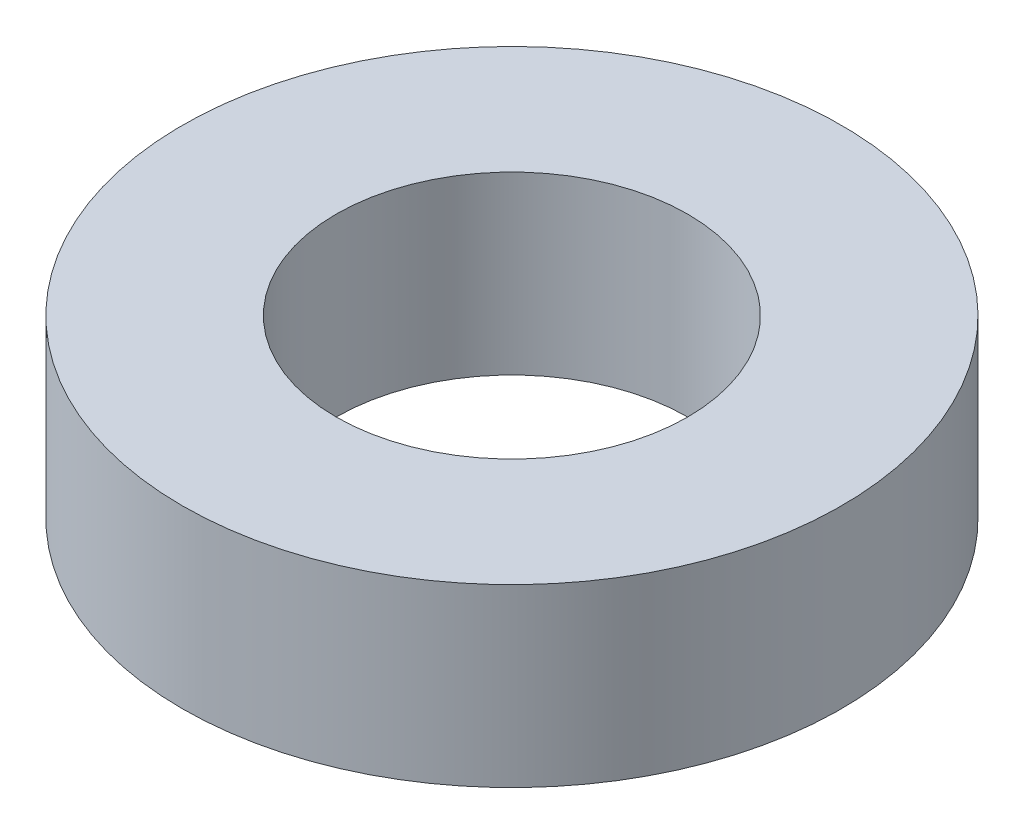
from build123d import *

# Parameters (mm, degrees)
SKETCH1_R           = 11.90625
SKETCH1_R_2         = 6.35
BOSS_EXTRUDE1_DEPTH = 6.35


with BuildPart() as part:
    # Sketch1 → Boss-Extrude1 (new body)
    with BuildSketch(Plane(origin=(0, 0, 0), x_dir=(1, 0, 0), z_dir=(0, 1, 0))):
        with Locations(Location((0, 0, 0), (0, 0, 270))):
            Circle(SKETCH1_R)
        with Locations(Location((0, 0, 0), (0, 0, 270))):
            Circle(SKETCH1_R_2, mode=Mode.SUBTRACT)
    extrude(amount=BOSS_EXTRUDE1_DEPTH)


solid = part.part
